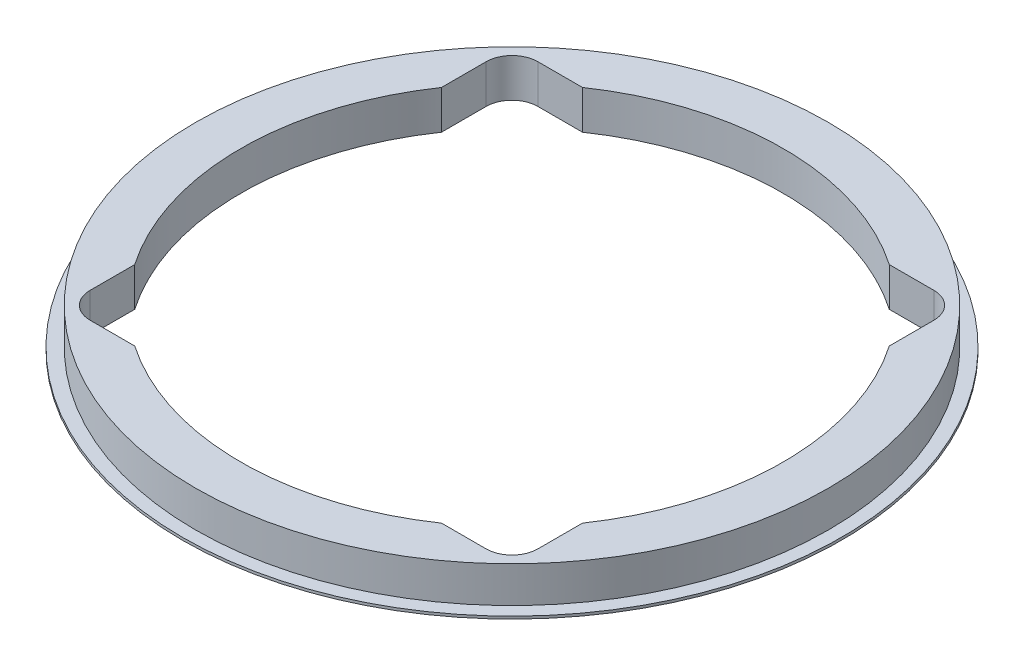
from build123d import *

# Parameters (mm, degrees)
SKETCH_1_R          = 24.5
SKETCH_1_R_2        = 21
EXTRUDE_1_DEPTH     = 3
SKETCH_2_R          = 25.5
SKETCH_2_R_2        = 24.5
EXTRUDE_2_DEPTH     = 0.2
CUT_EXTRUDE_START   = -3
CUT_EXTRUDE_3_DEPTH = 3


with BuildPart() as part:
    # 草图1 → 凸台-拉伸1 (new body)
    with BuildSketch(Plane(origin=(0, 0, 0), x_dir=(1, 0, 0), z_dir=(0, 1, 0))):
        with Locations(Location((0, 0, 0), (0, 0, 270))):
            Circle(SKETCH_1_R)
        with Locations(Location((0, 0, 0), (0, 0, 270))):
            Circle(SKETCH_1_R_2, mode=Mode.SUBTRACT)
    extrude(amount=EXTRUDE_1_DEPTH)

    # 草图2 → 凸台-拉伸2 (add)
    with BuildSketch(Plane.XZ):
        with Locations(Location((0, 0, 0), (0, 0, 270))):
            Circle(SKETCH_2_R)
        with Locations(Location((0, 0, 0), (0, 0, 270))):
            Circle(SKETCH_2_R_2, mode=Mode.SUBTRACT)
    extrude(amount=-EXTRUDE_2_DEPTH)

    # 草图3 → 切除-拉伸3 (cut)
    with BuildSketch(Plane(origin=(0, 3, 0), x_dir=(1, 0, 0), z_dir=(0, 1, 0)).offset(CUT_EXTRUDE_START)):
        with BuildLine():
            Line((-15.324116139, 17.324116139), (15.324116139, 17.324116139))
            ThreePointArc((15.324116139, 17.324116139), (16.738329701, 16.738329701), (17.324116139, 15.324116139))
            Line((17.324116139, 15.324116139), (17.324116139, -15.324116139))
            ThreePointArc((17.324116139, -15.324116139), (16.738329701, -16.738329701), (15.324116139, -17.324116139))
            Line((15.324116139, -17.324116139), (-15.324116139, -17.324116139))
            ThreePointArc((-15.324116139, -17.324116139), (-16.738329701, -16.738329701), (-17.324116139, -15.324116139))
            Line((-17.324116139, -15.324116139), (-17.324116139, 15.324116139))
            ThreePointArc((-17.324116139, 15.324116139), (-16.738329701, 16.738329701), (-15.324116139, 17.324116139))
        make_face()
    extrude(amount=CUT_EXTRUDE_3_DEPTH, mode=Mode.SUBTRACT)


solid = part.part
